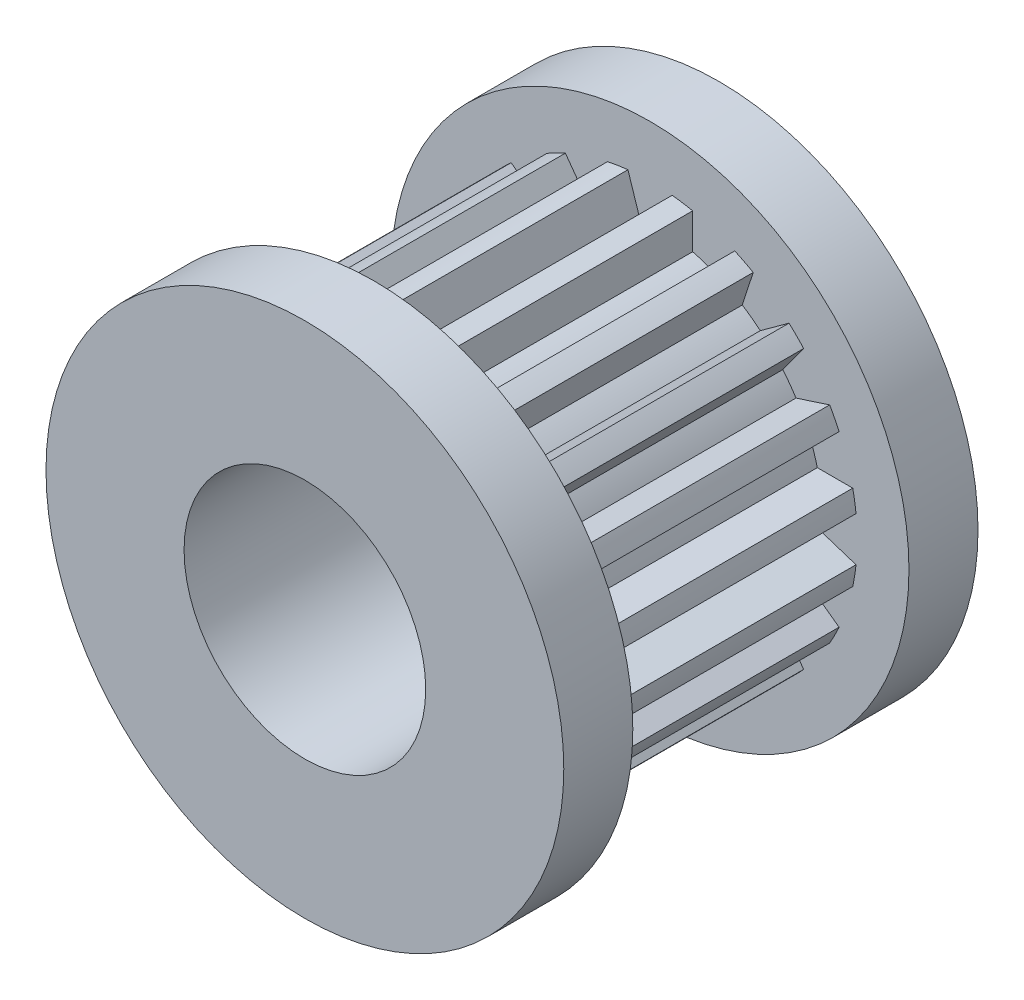
from build123d import *

# Parameters (mm, degrees)
BOSS_EXTRUDE1_DEPTH = 8
SKETCH3_R           = 7.5
BOSS_EXTRUDE2_DEPTH = 2
BOSS_EXTRUDE3_START = 2
SKETCH4_R           = 7.5
BOSS_EXTRUDE3_DEPTH = 2
SKETCH5_R           = 3.5
CUT_EXTRUDE1_DEPTH  = 17.015617378


with BuildPart() as part:
    # Sketch2 → Boss-Extrude1 (new body)
    with BuildSketch(Plane.XY):
        with BuildLine():
            Line((0.323954703, 4.989494298), (0.641126295, 5.965648085))
            ThreePointArc((0.641126295, 5.965648085), (0.93860679, 5.926130044), (1.2337393, 5.871787406))
            Line((1.2337393, 5.871787406), (1.2337393, 4.845398574))
            ThreePointArc((1.2337393, 4.845398574), (1.390142549, 4.802864114), (1.545084972, 4.755282581))
            ThreePointArc((1.545084972, 4.755282581), (1.698403748, 4.702703978), (1.849937763, 4.645183556))
            Line((1.849937763, 4.645183556), (2.453233982, 5.475549564))
            ThreePointArc((2.453233982, 5.475549564), (2.723942998, 5.346039145), (2.987837896, 5.203155264))
            Line((2.987837896, 5.203155264), (2.670666304, 4.227001478))
            ThreePointArc((2.670666304, 4.227001478), (2.806270762, 4.13821754), (2.938926261, 4.045084972))
            ThreePointArc((2.938926261, 4.045084972), (3.068493401, 3.947701641), (3.194836025, 3.846169883))
            Line((3.194836025, 3.846169883), (4.025202033, 4.449466102))
            ThreePointArc((4.025202033, 4.449466102), (4.242640687, 4.242640687), (4.449466102, 4.025202033))
            Line((4.449466102, 4.025202033), (3.846169883, 3.194836025))
            ThreePointArc((3.846169883, 3.194836025), (3.947701641, 3.068493401), (4.045084972, 2.938926261))
            ThreePointArc((4.045084972, 2.938926261), (4.13821754, 2.806270762), (4.227001478, 2.670666304))
            Line((4.227001478, 2.670666304), (5.203155264, 2.987837896))
            ThreePointArc((5.203155264, 2.987837896), (5.346039145, 2.723942998), (5.475549564, 2.453233982))
            Line((5.475549564, 2.453233982), (4.645183556, 1.849937763))
            ThreePointArc((4.645183556, 1.849937763), (4.702703978, 1.698403748), (4.755282581, 1.545084972))
            ThreePointArc((4.755282581, 1.545084972), (4.802864114, 1.390142549), (4.845398574, 1.2337393))
            Line((4.845398574, 1.2337393), (5.871787406, 1.2337393))
            ThreePointArc((5.871787406, 1.2337393), (5.926130044, 0.93860679), (5.965648085, 0.641126295))
            Line((5.965648085, 0.641126295), (4.989494298, 0.323954703))
            ThreePointArc((4.989494298, 0.323954703), (4.997372884, 0.162062503), (5, 0))
            ThreePointArc((5, 0), (4.997372884, -0.162062503), (4.989494298, -0.323954703))
            Line((4.989494298, -0.323954703), (5.965648085, -0.641126295))
            ThreePointArc((5.965648085, -0.641126295), (5.926130044, -0.93860679), (5.871787406, -1.2337393))
            Line((5.871787406, -1.2337393), (4.845398574, -1.2337393))
            ThreePointArc((4.845398574, -1.2337393), (4.802864114, -1.390142549), (4.755282581, -1.545084972))
            ThreePointArc((4.755282581, -1.545084972), (4.702703978, -1.698403748), (4.645183556, -1.849937763))
            Line((4.645183556, -1.849937763), (5.475549564, -2.453233982))
            ThreePointArc((5.475549564, -2.453233982), (5.346039145, -2.723942998), (5.203155264, -2.987837896))
            Line((5.203155264, -2.987837896), (4.227001478, -2.670666304))
            ThreePointArc((4.227001478, -2.670666304), (4.13821754, -2.806270762), (4.045084972, -2.938926261))
            ThreePointArc((4.045084972, -2.938926261), (3.947701641, -3.068493401), (3.846169883, -3.194836025))
            Line((3.846169883, -3.194836025), (4.449466102, -4.025202033))
            ThreePointArc((4.449466102, -4.025202033), (4.242640687, -4.242640687), (4.025202033, -4.449466102))
            Line((4.025202033, -4.449466102), (3.194836025, -3.846169883))
            ThreePointArc((3.194836025, -3.846169883), (3.068493401, -3.947701641), (2.938926261, -4.045084972))
            ThreePointArc((2.938926261, -4.045084972), (2.806270762, -4.13821754), (2.670666304, -4.227001478))
            Line((2.670666304, -4.227001478), (2.987837896, -5.203155264))
            ThreePointArc((2.987837896, -5.203155264), (2.723942998, -5.346039145), (2.453233982, -5.475549564))
            Line((2.453233982, -5.475549564), (1.849937763, -4.645183556))
            ThreePointArc((1.849937763, -4.645183556), (1.698403748, -4.702703978), (1.545084972, -4.755282581))
            ThreePointArc((1.545084972, -4.755282581), (1.390142549, -4.802864114), (1.2337393, -4.845398574))
            Line((1.2337393, -4.845398574), (1.2337393, -5.871787406))
            ThreePointArc((1.2337393, -5.871787406), (0.93860679, -5.926130044), (0.641126295, -5.965648085))
            Line((0.641126295, -5.965648085), (0.323954703, -4.989494298))
            ThreePointArc((0.323954703, -4.989494298), (0.162062503, -4.997372884), (0, -5))
            ThreePointArc((0, -5), (-0.162062503, -4.997372884), (-0.323954703, -4.989494298))
            Line((-0.323954703, -4.989494298), (-0.641126295, -5.965648085))
            ThreePointArc((-0.641126295, -5.965648085), (-0.93860679, -5.926130044), (-1.2337393, -5.871787406))
            Line((-1.2337393, -5.871787406), (-1.2337393, -4.845398574))
            ThreePointArc((-1.2337393, -4.845398574), (-1.390142549, -4.802864114), (-1.545084972, -4.755282581))
            ThreePointArc((-1.545084972, -4.755282581), (-1.698403748, -4.702703978), (-1.849937763, -4.645183556))
            Line((-1.849937763, -4.645183556), (-2.453233982, -5.475549564))
            ThreePointArc((-2.453233982, -5.475549564), (-2.723942998, -5.346039145), (-2.987837896, -5.203155264))
            Line((-2.987837896, -5.203155264), (-2.670666304, -4.227001478))
            ThreePointArc((-2.670666304, -4.227001478), (-2.806270762, -4.13821754), (-2.938926261, -4.045084972))
            ThreePointArc((-2.938926261, -4.045084972), (-3.068493401, -3.947701641), (-3.194836025, -3.846169883))
            Line((-3.194836025, -3.846169883), (-4.025202033, -4.449466102))
            ThreePointArc((-4.025202033, -4.449466102), (-4.242640687, -4.242640687), (-4.449466102, -4.025202033))
            Line((-4.449466102, -4.025202033), (-3.846169883, -3.194836025))
            ThreePointArc((-3.846169883, -3.194836025), (-3.947701641, -3.068493401), (-4.045084972, -2.938926261))
            ThreePointArc((-4.045084972, -2.938926261), (-4.13821754, -2.806270762), (-4.227001478, -2.670666304))
            Line((-4.227001478, -2.670666304), (-5.203155264, -2.987837896))
            ThreePointArc((-5.203155264, -2.987837896), (-5.346039145, -2.723942998), (-5.475549564, -2.453233982))
            Line((-5.475549564, -2.453233982), (-4.645183556, -1.849937763))
            ThreePointArc((-4.645183556, -1.849937763), (-4.702703978, -1.698403748), (-4.755282581, -1.545084972))
            ThreePointArc((-4.755282581, -1.545084972), (-4.802864114, -1.390142549), (-4.845398574, -1.2337393))
            Line((-4.845398574, -1.2337393), (-5.871787406, -1.2337393))
            ThreePointArc((-5.871787406, -1.2337393), (-5.926130044, -0.93860679), (-5.965648085, -0.641126295))
            Line((-5.965648085, -0.641126295), (-4.989494298, -0.323954703))
            ThreePointArc((-4.989494298, -0.323954703), (-4.997372884, -0.162062503), (-5, 0))
            ThreePointArc((-5, 0), (-4.997372884, 0.162062503), (-4.989494298, 0.323954703))
            Line((-4.989494298, 0.323954703), (-5.965648085, 0.641126295))
            ThreePointArc((-5.965648085, 0.641126295), (-5.926130044, 0.93860679), (-5.871787406, 1.2337393))
            Line((-5.871787406, 1.2337393), (-4.845398574, 1.2337393))
            ThreePointArc((-4.845398574, 1.2337393), (-4.802864114, 1.390142549), (-4.755282581, 1.545084972))
            ThreePointArc((-4.755282581, 1.545084972), (-4.702703978, 1.698403748), (-4.645183556, 1.849937763))
            Line((-4.645183556, 1.849937763), (-5.475549564, 2.453233982))
            ThreePointArc((-5.475549564, 2.453233982), (-5.346039145, 2.723942998), (-5.203155264, 2.987837896))
            Line((-5.203155264, 2.987837896), (-4.227001478, 2.670666304))
            ThreePointArc((-4.227001478, 2.670666304), (-4.13821754, 2.806270762), (-4.045084972, 2.938926261))
            ThreePointArc((-4.045084972, 2.938926261), (-3.947701641, 3.068493401), (-3.846169883, 3.194836025))
            Line((-3.846169883, 3.194836025), (-4.449466102, 4.025202033))
            ThreePointArc((-4.449466102, 4.025202033), (-4.242640687, 4.242640687), (-4.025202033, 4.449466102))
            Line((-4.025202033, 4.449466102), (-3.194836025, 3.846169883))
            ThreePointArc((-3.194836025, 3.846169883), (-3.068493401, 3.947701641), (-2.938926261, 4.045084972))
            ThreePointArc((-2.938926261, 4.045084972), (-2.806270762, 4.13821754), (-2.670666304, 4.227001478))
            Line((-2.670666304, 4.227001478), (-2.987837896, 5.203155264))
            ThreePointArc((-2.987837896, 5.203155264), (-2.723942998, 5.346039145), (-2.453233982, 5.475549564))
            Line((-2.453233982, 5.475549564), (-1.849937763, 4.645183556))
            ThreePointArc((-1.849937763, 4.645183556), (-1.698403748, 4.702703978), (-1.545084972, 4.755282581))
            ThreePointArc((-1.545084972, 4.755282581), (-1.390142549, 4.802864114), (-1.2337393, 4.845398574))
            Line((-1.2337393, 4.845398574), (-1.2337393, 5.871787406))
            ThreePointArc((-1.2337393, 5.871787406), (-0.93860679, 5.926130044), (-0.641126295, 5.965648085))
            Line((-0.641126295, 5.965648085), (-0.323954703, 4.989494298))
            ThreePointArc((-0.323954703, 4.989494298), (-0.162062503, 4.997372884), (0, 5))
            ThreePointArc((0, 5), (0.162062503, 4.997372884), (0.323954703, 4.989494298))
        make_face()
    extrude(amount=BOSS_EXTRUDE1_DEPTH)

    # Sketch3 → Boss-Extrude2 (add)
    with BuildSketch(Plane.XY.offset(8)):
        Circle(SKETCH3_R)
    extrude(amount=BOSS_EXTRUDE2_DEPTH)

    # Sketch4 → Boss-Extrude3 (add)
    with BuildSketch(Plane(origin=(0, 0, 0), x_dir=(-1, 0, 0), z_dir=(0, 0, -1)).offset(BOSS_EXTRUDE3_START)):
        with Locations(Location((0, 0, 0), (0, 0, 180))):
            Circle(SKETCH4_R)
    extrude(amount=-BOSS_EXTRUDE3_DEPTH)

    # Sketch5 → Cut-Extrude1 (cut, through all)
    with BuildSketch(Plane(origin=(0, 0, -2), x_dir=(-1, 0, 0), z_dir=(0, 0, -1))):
        Circle(SKETCH5_R)
    extrude(amount=-CUT_EXTRUDE1_DEPTH, mode=Mode.SUBTRACT)


solid = part.part
